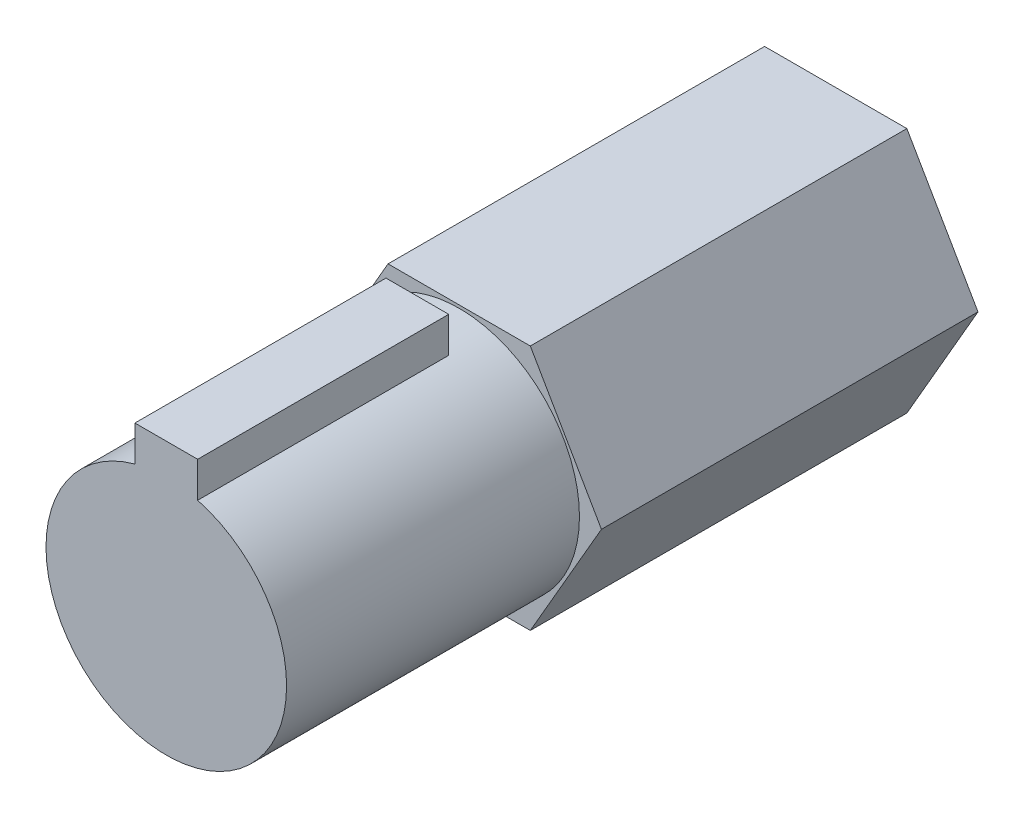
from build123d import *

# Parameters (mm, degrees)
BOSS_EXTRUDE1_DEPTH = 9
SKETCH2_R           = 2.875
BOSS_EXTRUDE2_DEPTH = 7
SKETCH3_W           = 1.5
SKETCH3_H           = 1.5
BOSS_EXTRUDE3_DEPTH = 6


with BuildPart() as part:
    # Sketch1 → Boss-Extrude1 (new body)
    with BuildSketch(Plane.XY):
        Polygon((3.4, 0), (1.7, 2.944486373), (-1.7, 2.944486373), (-3.4, 0), (-1.7, -2.944486373), (1.7, -2.944486373), align=None)
    extrude(amount=BOSS_EXTRUDE1_DEPTH)

    # Sketch2 → Boss-Extrude2 (add)
    with BuildSketch(Plane.XY.offset(9)):
        Circle(SKETCH2_R)
    extrude(amount=BOSS_EXTRUDE2_DEPTH)

    # Sketch3 → Boss-Extrude3 (add)
    with BuildSketch(Plane.XY.offset(16)):
        with Locations((0, 2.875)):
            Rectangle(SKETCH3_W, SKETCH3_H)
    extrude(amount=-BOSS_EXTRUDE3_DEPTH)


solid = part.part
